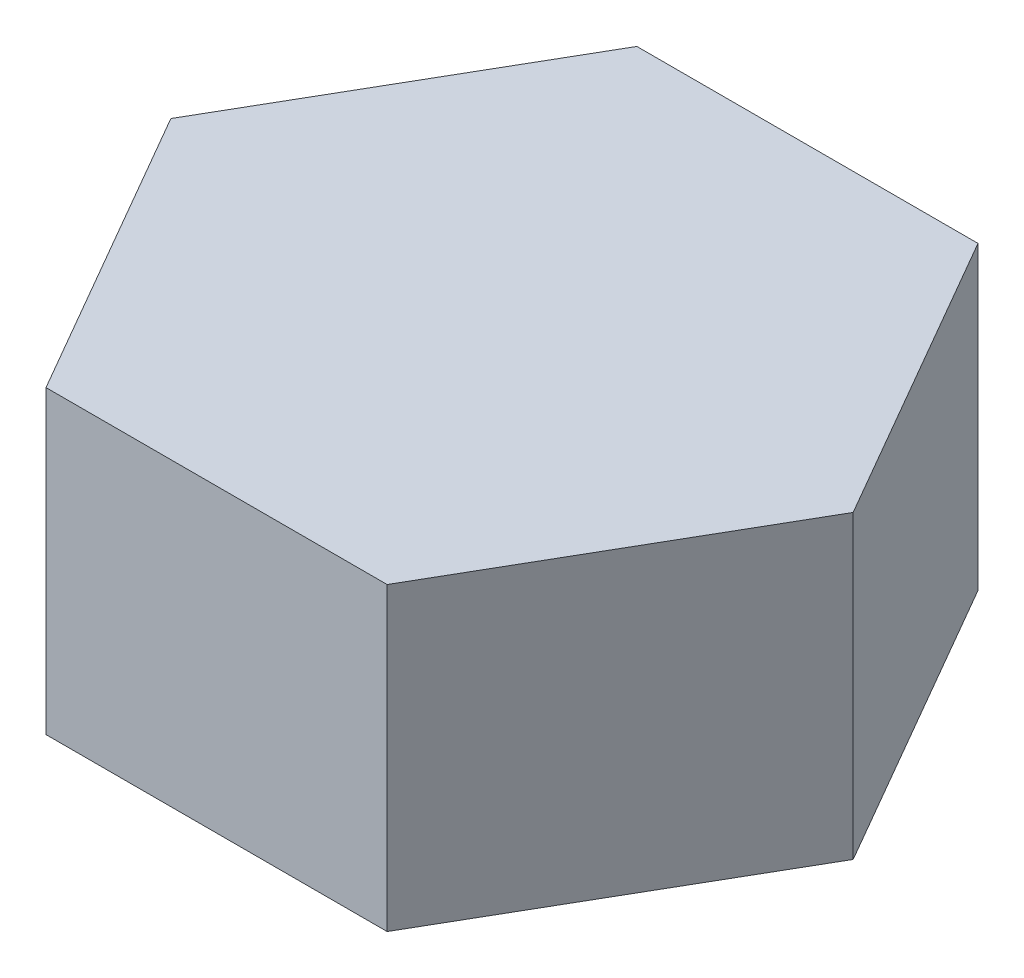
from build123d import *

# Parameters (mm, degrees)
BOSS_EXTRUDE1_DEPTH = 5.6007


with BuildPart() as part:
    # Sketch1 → Boss-Extrude1 (new body)
    with BuildSketch(Plane(origin=(0, 0, 0), x_dir=(1, 0, 0), z_dir=(0, 1, 0))):
        Polygon((-3.17857304, -5.50545), (-6.357146079, 0), (-3.17857304, 5.50545), (3.17857304, 5.50545), (6.357146079, 0), (3.17857304, -5.50545), align=None)
    extrude(amount=BOSS_EXTRUDE1_DEPTH)


solid = part.part
